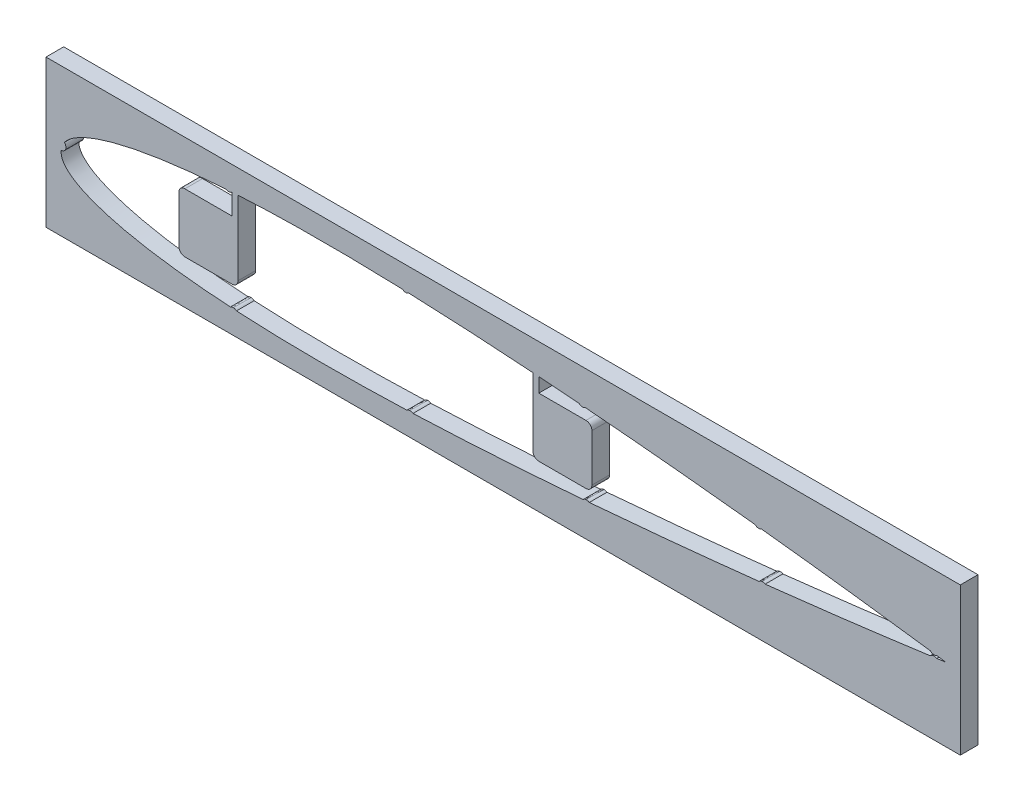
from build123d import *

# Parameters (mm, degrees)
SKETCH1_W           = 155
SKETCH1_H           = 25
BOSS_EXTRUDE1_DEPTH = 3
BOSS_EXTRUDE2_DEPTH = 3


with BuildPart() as part:
    # Sketch1 → Boss-Extrude1 (new body)
    with BuildSketch(Plane.XY):
        with Locations((-75.043432089, 5.950539177)):
            Rectangle(SKETCH1_W, SKETCH1_H)
        with BuildLine():
            Line((-120, 9.874355653), (-120, 1.874355653))
            ThreePointArc((-120, 1.874355653), (-120.292893219, 1.167248872), (-121, 0.874355653))
            Line((-121, 0.874355653), (-129, 0.874355653))
            ThreePointArc((-129, 0.874355653), (-129.707106781, 1.167248872), (-130, 1.874355653))
            Line((-130, 1.874355653), (-130, 10.026722702))
            ThreePointArc((-130, 10.026722702), (-129.675550532, 10.657645959), (-129, 10.874355653))
            Line((-129, 10.874355653), (-121, 10.874355653))
            Line((-121, 10.874355653), (-121, 14.383326896))
            add(Edge.make_bspline(
                [(-121, 14.383326896), (-121.225576082, 14.369446114), (-121.451128395, 14.355173583), (-121.676654377, 14.340496788)],
                knots=[0.794177557, 0.794177557, 0.794177557, 0.794177557, 0.798610741, 0.798610741, 0.798610741, 0.798610741], degree=3))
            add(Edge.make_bspline(
                [(-121.676654377, 14.340496788), (-123.141105811, 14.245193122), (-126.297275544, 14.002874731), (-130.966734827, 13.502135757), (-135.497553137, 12.829809722), (-138.919133497, 12.147248004), (-141.359035554, 11.532761702), (-142.966827408, 11.063139396), (-144.416586431, 10.569495063), (-145.705237538, 10.053484757), (-146.830159663, 9.516645923), (-147.789559274, 8.960196413), (-148.581406261, 8.384767274), (-149.206481665, 7.789808738), (-149.656785508, 7.173218222), (-149.945875273, 6.532334184), (-149.982262321, 6.089987443), (-150, 5.874355653)],
                knots=[0.798610741, 0.798610741, 0.798610741, 0.798610741, 0.827397593, 0.860698922, 0.890714333, 0.917222971, 0.929108019, 0.940059875, 0.950070168, 0.959138357, 0.967273832, 0.974500444, 0.980862986, 0.986437694, 0.991348141, 0.995782458, 1, 1, 1, 1], degree=3))
            add(Edge.make_bspline(
                [(-150, 5.874355653), (-149.982262321, 5.658723863), (-149.945875273, 5.216377122), (-149.656785508, 4.575493084), (-149.206481665, 3.958902568), (-148.581406261, 3.363944032), (-147.789559274, 2.788514893), (-146.830159663, 2.232065383), (-145.705237538, 1.695226549), (-144.416586431, 1.179216243), (-142.966827408, 0.68557191), (-141.359035554, 0.215949604), (-138.919133497, -0.398536698), (-135.497553137, -1.081098416), (-130.966734827, -1.753424451), (-125.915261757, -2.295129452), (-120.38969962, -2.698994916), (-113.346553824, -3.009849161), (-104.731447134, -3.120130228), (-94.550753071, -2.949624906), (-82.752820162, -2.472217615), (-69.615872509, -1.650520242), (-55.524910334, -0.507029139), (-41.215806763, 0.858742961), (-26.872092978, 2.413058536), (-13.42085951, 4.046159872), (-4.579151205, 5.229553883), (-0.494806727, 5.804304424), (-0.029189696, 5.870223183), (0, 5.874355653)],
                knots=[0, 0, 0, 0, 0.004217542, 0.008651859, 0.013562306, 0.019137014, 0.025499556, 0.032726168, 0.040861643, 0.049929832, 0.059940125, 0.070891981, 0.082777029, 0.109285667, 0.139301078, 0.172602407, 0.208924358, 0.247964735, 0.310881146, 0.377906083, 0.447678538, 0.542484027, 0.636086648, 0.724985379, 0.824439816, 0.919092539, 0.990775422, 0.999421708, 1, 1, 1, 1], degree=3))
            add(Edge.make_bspline(
                [(0, 5.874355653), (-0.029189696, 5.878488123), (-0.494806727, 5.944406882), (-4.579151205, 6.519157423), (-13.42085951, 7.702551434), (-26.872092978, 9.33565277), (-41.215806763, 10.889968345), (-55.339276668, 12.238022124), (-64.426731221, 12.978076031), (-69, 13.310196316)],
                knots=[0, 0, 0, 0, 0.000578292, 0.009224578, 0.080907461, 0.175560184, 0.275014621, 0.363913352, 0.453858128, 0.453858128, 0.453858128, 0.453858128], degree=3))
            Line((-69, 13.310196316), (-69, 10.874355653))
            Line((-69, 10.874355653), (-61, 10.874355653))
            ThreePointArc((-61, 10.874355653), (-60.292893219, 10.581462434), (-60, 9.874355653))
            Line((-60, 9.874355653), (-60, 1.874355653))
            ThreePointArc((-60, 1.874355653), (-60.292893219, 1.167248872), (-61, 0.874355653))
            Line((-61, 0.874355653), (-69, 0.874355653))
            ThreePointArc((-69, 0.874355653), (-69.707106781, 1.167248872), (-70, 1.874355653))
            Line((-70, 1.874355653), (-70, 9.874355653))
            Line((-70, 9.874355653), (-70, 13.382173037))
            add(Edge.make_bspline(
                [(-70, 13.382173037), (-74.673521975, 13.715522929), (-82.900428949, 14.22690196), (-94.550753071, 14.698336212), (-104.731447134, 14.868841534), (-113.170765072, 14.76081072), (-118.188410859, 14.544675383), (-120, 14.442325619)],
                knots=[0.460413652, 0.460413652, 0.460413652, 0.460413652, 0.552321462, 0.622093917, 0.689118854, 0.752035265, 0.787627618, 0.787627618, 0.787627618, 0.787627618], degree=3))
            Line((-120, 14.442325619), (-120, 9.874355653))
        make_face(mode=Mode.SUBTRACT)
    extrude(amount=BOSS_EXTRUDE1_DEPTH)

    # Sketch3 → Boss-Extrude2 (add)
    with BuildSketch(Plane.XY.offset(3)):
        with BuildLine():
            add(Edge.make_bspline(
                [(-1.870066252, 7.63933004), (-1.925569281, 7.644199553), (-2.034516531, 7.653757951), (-2.196277727, 7.628927154), (-2.349447825, 7.572035144), (-2.489016071, 7.482956839), (-2.612515344, 7.372139614), (-2.709996679, 7.239879331), (-2.779310689, 7.089119128), (-2.800168177, 6.9799255), (-2.810860739, 6.923947535)],
                knots=[0, 0, 0, 0, 1.01487162, 1.992097965, 2.960683225, 3.979797821, 4.998693386, 5.975234306, 6.962006619, 8, 8, 8, 8], degree=3))
            add(Edge.make_bspline(
                [(-2.810860739, 6.923947535), (-2.815711098, 6.868455422), (-2.825231899, 6.759529601), (-2.800532801, 6.596679966), (-2.741813637, 6.442885963), (-2.654617941, 6.300420475), (-2.542394397, 6.17824584), (-2.413843576, 6.077637994), (-2.264635334, 6.010357663), (-2.157866662, 5.988321439), (-2.103451068, 5.977090484)],
                knots=[0, 0, 0, 0, 1.017250327, 1.996767144, 2.984718075, 4.014456741, 5.035740444, 6.007519375, 6.984514713, 8, 8, 8, 8], degree=3))
            add(Edge.make_bspline(
                [(-2.103451068, 5.977090484), (-2.04790179, 5.971975695), (-1.938585288, 5.961910201), (-1.776672863, 5.99049312), (-1.621901708, 6.044932605), (-1.481516135, 6.135168193), (-1.358138666, 6.246782319), (-1.262837088, 6.380944607), (-1.193420628, 6.52981056), (-1.173002624, 6.63776912), (-1.162656581, 6.69247299)],
                knots=[0, 0, 0, 0, 1.015281961, 1.997993063, 2.976832369, 3.996359022, 5.026059393, 5.998794247, 6.98596554, 8, 8, 8, 8], degree=3))
            add(Edge.make_bspline(
                [(-1.162656581, 6.69247299), (-1.157391412, 6.749232604), (-1.147115979, 6.860003912), (-1.170946154, 7.024956792), (-1.229652859, 7.178523668), (-1.316652132, 7.31979596), (-1.427778496, 7.442576665), (-1.559377134, 7.539646112), (-1.708090284, 7.608700898), (-1.815374374, 7.62898798), (-1.870066252, 7.63933004)],
                knots=[0, 0, 0, 0, 1.037794969, 2.025346855, 3.010187337, 4.019462608, 5.037530918, 6.013278971, 6.987198353, 8, 8, 8, 8], degree=3))
        make_face()
        with BuildLine():
            add(Edge.make_bspline(
                [(-31.645039949, 11.33361577), (-31.700411186, 11.336691117), (-31.808842059, 11.342713424), (-31.968803391, 11.311625572), (-32.120580082, 11.25297175), (-32.256030981, 11.158720126), (-32.377390605, 11.046240351), (-32.469437656, 10.91041826), (-32.534627908, 10.757943572), (-32.551602656, 10.648525548), (-32.560336175, 10.592229898)],
                knots=[0, 0, 0, 0, 1.012917953, 1.983549283, 2.961176661, 3.974020675, 4.988932927, 5.977529819, 6.959437681, 8, 8, 8, 8], degree=3))
            add(Edge.make_bspline(
                [(-32.560336175, 10.592229898), (-32.564483473, 10.536348666), (-32.572567747, 10.427420098), (-32.540195137, 10.266478958), (-32.482619122, 10.113401498), (-32.389350322, 9.975913955), (-32.276527861, 9.854957115), (-32.142108077, 9.76339239), (-31.993299838, 9.695747345), (-31.885544916, 9.67957056), (-31.830475217, 9.671303182)],
                knots=[0, 0, 0, 0, 1.024721406, 1.99747629, 2.987400565, 4.010946832, 5.028079514, 6.007461816, 6.981684776, 8, 8, 8, 8], degree=3))
            add(Edge.make_bspline(
                [(-31.830475217, 9.671303182), (-31.775313486, 9.667607214), (-31.666549508, 9.660319769), (-31.505413171, 9.68946018), (-31.355136545, 9.753735432), (-31.216741938, 9.844785459), (-31.09647645, 9.960225428), (-31.003475206, 10.09587021), (-30.93945366, 10.247351932), (-30.921060213, 10.355079362), (-30.911707141, 10.409858787)],
                knots=[0, 0, 0, 0, 1.010507111, 1.992446048, 2.967035268, 3.988379424, 5.013529662, 6.002157841, 6.984096778, 8, 8, 8, 8], degree=3))
            add(Edge.make_bspline(
                [(-30.911707141, 10.409858787), (-30.908361579, 10.466484556), (-30.901847842, 10.576733701), (-30.931272893, 10.739691979), (-30.994277654, 10.890547056), (-31.083772626, 11.02938759), (-31.197317203, 11.14917838), (-31.331508162, 11.242287486), (-31.482564125, 11.305818063), (-31.590270985, 11.324245443), (-31.645039949, 11.33361577)],
                knots=[0, 0, 0, 0, 1.036127545, 2.017317846, 3.001172052, 4.012980307, 5.027150879, 6.003681006, 6.984871308, 8, 8, 8, 8], degree=3))
        make_face()
        with BuildLine():
            add(Edge.make_bspline(
                [(-61.526597035, 14.232079969), (-61.582283043, 14.234092449), (-61.691797379, 14.238050272), (-61.852541511, 14.20345358), (-62.002578369, 14.137051669), (-62.136157956, 14.038839832), (-62.253692012, 13.921463385), (-62.345554446, 13.783862325), (-62.404036387, 13.627422401), (-62.419299816, 13.517002449), (-62.427088277, 13.460658525)],
                knots=[0, 0, 0, 0, 1.011321663, 1.988905726, 2.963385499, 3.977771559, 4.989677632, 5.974717091, 6.966560061, 8, 8, 8, 8], degree=3))
            add(Edge.make_bspline(
                [(-62.427088277, 13.460658525), (-62.429128644, 13.404960829), (-62.433141312, 13.295423508), (-62.398023938, 13.134295319), (-62.332580417, 12.982715728), (-62.234381025, 12.847526942), (-62.119034312, 12.727567268), (-61.980559441, 12.639149795), (-61.828495734, 12.577384159), (-61.719684776, 12.562885614), (-61.664549435, 12.555539091)],
                knots=[0, 0, 0, 0, 1.014352598, 1.994866485, 2.982481805, 4.008566467, 5.030585686, 6.002494066, 6.987848531, 8, 8, 8, 8], degree=3))
            add(Edge.make_bspline(
                [(-61.664549435, 12.555539091), (-61.608804354, 12.553279676), (-61.498928558, 12.548826279), (-61.339157391, 12.587040561), (-61.187849995, 12.650639128), (-61.052597081, 12.748091523), (-60.935360191, 12.867099009), (-60.846525854, 13.005208663), (-60.786994832, 13.158688544), (-60.772269055, 13.267265218), (-60.764708996, 13.323007337)],
                knots=[0, 0, 0, 0, 1.014422888, 1.999468295, 2.970295884, 3.996451649, 5.021447424, 6.00460396, 6.975584712, 8, 8, 8, 8], degree=3))
            add(Edge.make_bspline(
                [(-60.764708996, 13.323007337), (-60.76242344, 13.379996716), (-60.757954684, 13.491423273), (-60.792199301, 13.654903047), (-60.858713551, 13.805921096), (-60.95357425, 13.943468027), (-61.073447621, 14.058590831), (-61.209066774, 14.151672928), (-61.363180163, 14.209426486), (-61.471594181, 14.224455259), (-61.526597035, 14.232079969)],
                knots=[0, 0, 0, 0, 1.034225871, 2.022135156, 3.005780226, 4.019261856, 5.040066372, 6.013007039, 6.991917418, 8, 8, 8, 8], degree=3))
        make_face()
        with BuildLine():
            add(Edge.make_bspline(
                [(-91.495436534, 16.053737794), (-91.55140781, 16.053308858), (-91.660944146, 16.052469428), (-91.820539926, 16.012008698), (-91.965989664, 15.937618086), (-92.097336485, 15.836882698), (-92.207932065, 15.713372857), (-92.292320259, 15.572479739), (-92.345185859, 15.415065538), (-92.355128503, 15.304598661), (-92.360238568, 15.247823728)],
                knots=[0, 0, 0, 0, 1.019009817, 1.994212216, 2.972532837, 3.98275666, 4.999430969, 5.980632802, 6.962137427, 8, 8, 8, 8], degree=3))
            add(Edge.make_bspline(
                [(-92.360238568, 15.247823728), (-92.359804754, 15.191854453), (-92.358955775, 15.082322032), (-92.318564368, 14.922697829), (-92.243678617, 14.776907862), (-92.143620312, 14.644901985), (-92.022712975, 14.530523883), (-91.881250306, 14.448309589), (-91.727126232, 14.391833231), (-91.618281602, 14.382406933), (-91.562744481, 14.377597237)],
                knots=[0, 0, 0, 0, 1.022319469, 2.000689238, 2.982187357, 4.00487245, 5.022794195, 6.007182883, 6.983180658, 8, 8, 8, 8], degree=3))
            add(Edge.make_bspline(
                [(-91.562744481, 14.377597237), (-91.506646554, 14.377628255), (-91.397283369, 14.377688724), (-91.239637511, 14.423576764), (-91.091104578, 14.492182198), (-90.961711806, 14.59700354), (-90.849386533, 14.719122426), (-90.768780487, 14.862025979), (-90.712492402, 15.016501293), (-90.702933546, 15.125980942), (-90.698084931, 15.181513172)],
                knots=[0, 0, 0, 0, 1.021787889, 1.991980517, 2.977374506, 3.998504286, 5.0179503, 5.996422219, 6.983709378, 8, 8, 8, 8], degree=3))
            add(Edge.make_bspline(
                [(-90.698084931, 15.181513172), (-90.698193618, 15.238232313), (-90.698406723, 15.349443222), (-90.74263803, 15.509628916), (-90.812499651, 15.658449728), (-90.914775354, 15.788482036), (-91.036018637, 15.90073782), (-91.176881172, 15.983099256), (-91.331067727, 16.039482512), (-91.439903786, 16.048921582), (-91.495436534, 16.053737794)],
                knots=[0, 0, 0, 0, 1.032493919, 2.024441557, 3.008473088, 4.020050434, 5.028456568, 6.010973038, 6.985114555, 8, 8, 8, 8], degree=3))
        make_face()
        with BuildLine():
            add(Edge.make_bspline(
                [(-121.588524465, 15.868630626), (-121.643778927, 15.863040165), (-121.752688882, 15.852021022), (-121.908694026, 15.799835738), (-122.047652038, 15.712588783), (-122.169840809, 15.600174994), (-122.271165571, 15.468356529), (-122.34428821, 15.320346092), (-122.384029345, 15.158665497), (-122.383704188, 15.047166294), (-122.383537886, 14.990139759)],
                knots=[0, 0, 0, 0, 1.009551691, 1.989888666, 2.964247229, 3.976579052, 5.000028149, 5.974917924, 6.96426692, 8, 8, 8, 8], degree=3))
            add(Edge.make_bspline(
                [(-122.383537886, 14.990139759), (-122.37798262, 14.934185606), (-122.367161857, 14.825195924), (-122.313889157, 14.668981987), (-122.227381639, 14.529035248), (-122.11523964, 14.405770469), (-121.984636675, 14.302469565), (-121.836793924, 14.231251342), (-121.677945416, 14.187640829), (-121.568012287, 14.187981496), (-121.512238118, 14.188154332)],
                knots=[0, 0, 0, 0, 1.024046003, 1.994676734, 2.982380645, 4.007006927, 5.024136818, 6.00125248, 6.985942794, 8, 8, 8, 8], degree=3))
            add(Edge.make_bspline(
                [(-121.512238118, 14.188154332), (-121.45688182, 14.193482042), (-121.347634798, 14.20399641), (-121.193236983, 14.259976061), (-121.051777181, 14.344132715), (-120.929291825, 14.457926767), (-120.830095783, 14.593153304), (-120.758030138, 14.741394933), (-120.717302642, 14.901344641), (-120.717250971, 15.01092541), (-120.717224697, 15.066645198)],
                knots=[0, 0, 0, 0, 1.010861704, 1.994960552, 2.965630447, 3.996252168, 5.021318713, 6.007675535, 6.986939972, 8, 8, 8, 8], degree=3))
            add(Edge.make_bspline(
                [(-120.717224697, 15.066645198), (-120.722892724, 15.123262021), (-120.734000635, 15.234216784), (-120.787263143, 15.392088741), (-120.871332488, 15.534109281), (-120.984278184, 15.656107801), (-121.116906219, 15.755416852), (-121.26370429, 15.828253871), (-121.42325457, 15.868477365), (-121.532815012, 15.868578964), (-121.588524465, 15.868630626)],
                knots=[0, 0, 0, 0, 1.034052986, 2.026484328, 3.00721666, 4.019723006, 5.03485659, 6.009914434, 6.98807841, 8, 8, 8, 8], degree=3))
        make_face()
        with BuildLine():
            add(Edge.make_bspline(
                [(-150.745376314, 7.254618318), (-150.768040718, 7.204108659), (-150.812615997, 7.104768646), (-150.841871361, 6.943717408), (-150.835817494, 6.780862404), (-150.800128369, 6.619748813), (-150.7342672, 6.468239039), (-150.641579508, 6.332766932), (-150.521548666, 6.218791206), (-150.425690709, 6.163448569), (-150.377025266, 6.13535206)],
                knots=[0, 0, 0, 0, 1.011876763, 1.990111407, 2.967733411, 3.981754218, 4.997251038, 5.976633352, 6.972771419, 8, 8, 8, 8], degree=3))
            add(Edge.make_bspline(
                [(-150.377025266, 6.13535206), (-150.32651187, 6.112624973), (-150.227164508, 6.067926412), (-150.065790145, 6.039505555), (-149.901724787, 6.042247056), (-149.740058576, 6.080961929), (-149.586798087, 6.144100331), (-149.450771409, 6.234994239), (-149.335968453, 6.352478689), (-149.282071641, 6.447650274), (-149.2546651, 6.496045049)],
                knots=[0, 0, 0, 0, 1.012421914, 1.991183585, 2.976282326, 4.002092948, 5.020863322, 6.001155744, 6.983587211, 8, 8, 8, 8], degree=3))
            add(Edge.make_bspline(
                [(-149.2546651, 6.496045049), (-149.231821768, 6.546532972), (-149.186703571, 6.646252405), (-149.160115554, 6.808132754), (-149.164335616, 6.97199253), (-149.204951204, 7.132281519), (-149.268757004, 7.285084643), (-149.364675355, 7.417286594), (-149.48079209, 7.533028339), (-149.576147699, 7.586793339), (-149.624636049, 7.614132855)],
                knots=[0, 0, 0, 0, 1.013255866, 2.001296436, 2.980250856, 4.002141009, 5.019021866, 5.999509257, 6.982749972, 8, 8, 8, 8], degree=3))
            add(Edge.make_bspline(
                [(-149.624636049, 7.614132855), (-149.676428516, 7.637662613), (-149.776978943, 7.683343525), (-149.939877018, 7.712133495), (-150.103194238, 7.708945132), (-150.264634103, 7.672382167), (-150.416256559, 7.606821394), (-150.550148394, 7.514555943), (-150.664432954, 7.39766197), (-150.7179816, 7.303030442), (-150.745376314, 7.254618318)],
                knots=[0, 0, 0, 0, 1.039565966, 2.018224041, 3.003218516, 4.017678243, 5.033614623, 6.013420864, 6.983694792, 8, 8, 8, 8], degree=3))
        make_face()
        with BuildLine():
            add(Edge.make_bspline(
                [(-120.851293542, -4.142264451), (-120.90651468, -4.136519536), (-121.015477821, -4.125183587), (-121.169249072, -4.06898928), (-121.309984884, -3.985322722), (-121.429448244, -3.870604341), (-121.530582502, -3.738552122), (-121.599323401, -3.588652206), (-121.63991024, -3.427289646), (-121.639012358, -3.31584607), (-121.638553158, -3.25885099)],
                knots=[0, 0, 0, 0, 1.009338913, 1.991642034, 2.958726526, 3.975532906, 4.993724234, 5.974516119, 6.964115998, 8, 8, 8, 8], degree=3))
            add(Edge.make_bspline(
                [(-121.638553158, -3.25885099), (-121.632998397, -3.202898868), (-121.622163823, -3.09376411), (-121.564192459, -2.940098861), (-121.482435358, -2.798311265), (-121.366261674, -2.678705064), (-121.235385298, -2.576350125), (-121.087530312, -2.504367176), (-120.928206408, -2.464500817), (-120.818789782, -2.465217389), (-120.763152517, -2.465581759)],
                knots=[0, 0, 0, 0, 1.024410703, 1.998115712, 2.97854022, 3.998352384, 5.026905955, 6.004816062, 6.985468832, 8, 8, 8, 8], degree=3))
            add(Edge.make_bspline(
                [(-120.763152517, -2.465581759), (-120.707986334, -2.471415401), (-120.599131631, -2.482926426), (-120.443899216, -2.538078751), (-120.305682522, -2.627191343), (-120.184813207, -2.740936435), (-120.08387544, -2.873372912), (-120.015518573, -3.022615385), (-119.974613827, -3.181857345), (-119.975461744, -3.291327521), (-119.975892901, -3.346992015)],
                knots=[0, 0, 0, 0, 1.012297478, 1.997479918, 2.980236169, 4.000023003, 5.021198845, 6.004865618, 6.985494031, 8, 8, 8, 8], degree=3))
            add(Edge.make_bspline(
                [(-119.975892901, -3.346992015), (-119.981565315, -3.403560568), (-119.992692461, -3.514526843), (-120.049230443, -3.670808556), (-120.132185765, -3.813425896), (-120.247593436, -3.933175557), (-120.379213733, -4.033715712), (-120.527388769, -4.103086765), (-120.686190021, -4.143466242), (-120.795639548, -4.142669557), (-120.851293542, -4.142264451)],
                knots=[0, 0, 0, 0, 1.033597219, 2.027529919, 3.005207022, 4.022161406, 5.040500939, 6.010407088, 6.988311813, 8, 8, 8, 8], degree=3))
        make_face()
        with BuildLine():
            add(Edge.make_bspline(
                [(-90.776728844, -4.281665047), (-90.832409421, -4.281397338), (-90.942046449, -4.28087021), (-91.100847977, -4.238455686), (-91.247959766, -4.167243647), (-91.379210322, -4.066527964), (-91.492030323, -3.944506297), (-91.572405469, -3.800468545), (-91.627377486, -3.64372604), (-91.637133952, -3.532926494), (-91.64211346, -3.476376586)],
                knots=[0, 0, 0, 0, 1.012391259, 1.99343427, 2.968786948, 3.977579692, 4.995454243, 5.977706926, 6.967861404, 8, 8, 8, 8], degree=3))
            add(Edge.make_bspline(
                [(-91.64211346, -3.476376586), (-91.641615757, -3.420759903), (-91.640637215, -3.311411012), (-91.601626934, -3.151844033), (-91.528847789, -3.005077396), (-91.429986096, -2.871622769), (-91.30594929, -2.760436576), (-91.166838993, -2.674326489), (-91.01150463, -2.619691655), (-90.902695518, -2.609971803), (-90.846841024, -2.604982355)],
                knots=[0, 0, 0, 0, 1.015751309, 1.997085679, 2.975675479, 3.997586468, 5.018839269, 6.006245371, 6.976554883, 8, 8, 8, 8], degree=3))
            add(Edge.make_bspline(
                [(-90.846841024, -2.604982355), (-90.791192801, -2.605319478), (-90.681619479, -2.605983287), (-90.522647127, -2.6473223), (-90.377170735, -2.722280368), (-90.246726536, -2.82395092), (-90.134246144, -2.946324757), (-90.051763149, -3.087364593), (-89.993415502, -3.241064604), (-89.984182882, -3.350303563), (-89.979453203, -3.406264406)],
                knots=[0, 0, 0, 0, 1.016655847, 2.001831396, 2.97577537, 3.996252141, 5.018414379, 6.000394015, 6.975643493, 8, 8, 8, 8], degree=3))
            add(Edge.make_bspline(
                [(-89.979453203, -3.406264406), (-89.97969062, -3.463275077), (-89.980155403, -3.574883356), (-90.022268879, -3.735817063), (-90.09421652, -3.884427362), (-90.195927365, -4.015473112), (-90.316967843, -4.129284984), (-90.457486113, -4.211809962), (-90.611952172, -4.267121628), (-90.720835999, -4.276731867), (-90.776728844, -4.281665047)],
                knots=[0, 0, 0, 0, 1.036123955, 2.028392401, 3.00317457, 4.028438216, 5.036714415, 6.014002944, 6.980537043, 8, 8, 8, 8], degree=3))
        make_face()
        with BuildLine():
            add(Edge.make_bspline(
                [(-60.832379514, -2.431423628), (-60.887915289, -2.432888556), (-60.997379729, -2.43577602), (-61.158199886, -2.403104009), (-61.308287377, -2.336440094), (-61.44467726, -2.240950003), (-61.561973618, -2.122380488), (-61.653388079, -1.984846691), (-61.712596197, -1.829238782), (-61.727959678, -1.718755092), (-61.735825027, -1.662192858)],
                knots=[0, 0, 0, 0, 1.008658703, 1.988128532, 2.956683018, 3.978070927, 5.000614742, 5.97464219, 6.963116067, 8, 8, 8, 8], degree=3))
            add(Edge.make_bspline(
                [(-61.735825027, -1.662192858), (-61.738558323, -1.605886692), (-61.743889263, -1.496068839), (-61.705363722, -1.336150559), (-61.644412528, -1.183928991), (-61.546269228, -1.048821526), (-61.431661698, -0.927602909), (-61.293026283, -0.838514392), (-61.141089623, -0.775100959), (-61.031971143, -0.761593762), (-60.976610283, -0.754740935)],
                knots=[0, 0, 0, 0, 1.02379044, 1.996770059, 2.974622982, 3.999066142, 5.024668667, 6.001609697, 6.986124027, 8, 8, 8, 8], degree=3))
            add(Edge.make_bspline(
                [(-60.976610283, -0.754740935), (-60.920318317, -0.75204672), (-60.810528161, -0.746792004), (-60.650152772, -0.784827633), (-60.498625449, -0.847993751), (-60.364845091, -0.94831006), (-60.246807728, -1.065520648), (-60.156160461, -1.202931501), (-60.096594584, -1.356200441), (-60.08106791, -1.464725567), (-60.07316477, -1.519965294)],
                knots=[0, 0, 0, 0, 1.023850534, 1.996887265, 2.97957142, 4.001170373, 5.026833098, 6.003831472, 6.983942161, 8, 8, 8, 8], degree=3))
            add(Edge.make_bspline(
                [(-60.07316477, -1.519965294), (-60.070802796, -1.57684455), (-60.066173763, -1.688317394), (-60.099692473, -1.851657958), (-60.165449328, -2.003575022), (-60.261782237, -2.139493326), (-60.378197829, -2.258260742), (-60.51538139, -2.348370907), (-60.668605348, -2.408008702), (-60.777136645, -2.42352551), (-60.832379514, -2.431423628)],
                knots=[0, 0, 0, 0, 1.032450455, 2.023412341, 3.002692539, 4.023647015, 5.037131964, 6.010746077, 6.987461722, 8, 8, 8, 8], degree=3))
        make_face()
        with BuildLine():
            add(Edge.make_bspline(
                [(-30.978546282, 0.484203935), (-31.034035319, 0.480488134), (-31.142488611, 0.473225603), (-31.303163294, 0.503091865), (-31.453526502, 0.565056399), (-31.593020051, 0.654216915), (-31.712571254, 0.769203713), (-31.804477908, 0.904506698), (-31.869308206, 1.056291694), (-31.886952059, 1.165362742), (-31.896014231, 1.221383422)],
                knots=[0, 0, 0, 0, 1.01617143, 1.986106501, 2.963426972, 3.981954403, 5.003345863, 5.981049462, 6.963033878, 8, 8, 8, 8], degree=3))
            add(Edge.make_bspline(
                [(-31.896014231, 1.221383422), (-31.899755049, 1.276898326), (-31.907110834, 1.386060448), (-31.876445645, 1.547382192), (-31.818415351, 1.700554611), (-31.727091962, 1.839202711), (-31.615210039, 1.96190385), (-31.480616098, 2.05492298), (-31.330608774, 2.119838832), (-31.223531023, 2.13772861), (-31.168850769, 2.146864191)],
                knots=[0, 0, 0, 0, 1.01730789, 2.000390532, 2.98568518, 4.005351705, 5.028325863, 6.014077547, 6.985870166, 8, 8, 8, 8], degree=3))
            add(Edge.make_bspline(
                [(-31.168850769, 2.146864191), (-31.113316433, 2.150768381), (-31.003995347, 2.158453901), (-30.843207006, 2.125442251), (-30.691497621, 2.065057614), (-30.554718368, 1.97188749), (-30.434711259, 1.857551862), (-30.341664215, 1.723103896), (-30.273570739, 1.573331286), (-30.256250483, 1.465124631), (-30.247376411, 1.409684704)],
                knots=[0, 0, 0, 0, 1.016266219, 2.000551976, 2.977963612, 3.99304967, 5.014536406, 5.999278732, 6.974925878, 8, 8, 8, 8], degree=3))
            add(Edge.make_bspline(
                [(-30.247376411, 1.409684704), (-30.243606099, 1.3528473), (-30.236278002, 1.242376303), (-30.266450512, 1.079254926), (-30.327272528, 0.926409579), (-30.419778145, 0.788484443), (-30.532070483, 0.667659579), (-30.666069074, 0.57524182), (-30.81629745, 0.511616738), (-30.923905739, 0.493435746), (-30.978546282, 0.484203935)],
                knots=[0, 0, 0, 0, 1.039082297, 2.019593563, 3.006784345, 4.030444087, 5.041847504, 6.008011484, 6.98852275, 8, 8, 8, 8], degree=3))
        make_face()
        with BuildLine():
            add(Edge.make_bspline(
                [(-1.883012821, 4.125557576), (-1.938481198, 4.121185306), (-2.047419907, 4.11259826), (-2.208402794, 4.140557219), (-2.360678039, 4.198247513), (-2.501396189, 4.285399737), (-2.622478892, 4.399012752), (-2.71981565, 4.531291556), (-2.785167743, 4.683789609), (-2.805871829, 4.792748349), (-2.81650641, 4.848714627)],
                knots=[0, 0, 0, 0, 1.014040895, 1.991554677, 2.957563385, 3.977394448, 4.996713787, 5.976055838, 6.960408122, 8, 8, 8, 8], degree=3))
            add(Edge.make_bspline(
                [(-2.81650641, 4.848714627), (-2.820851497, 4.90418678), (-2.829436786, 5.013792051), (-2.801401386, 5.175993334), (-2.744435113, 5.330013899), (-2.655996968, 5.471164559), (-2.544021379, 5.593726662), (-2.412348079, 5.690917252), (-2.263708554, 5.759510717), (-2.156107386, 5.778537438), (-2.101362179, 5.788217832)],
                knots=[0, 0, 0, 0, 1.015331675, 2.006154428, 2.984836147, 4.005965362, 5.03554826, 6.006256878, 6.985625525, 8, 8, 8, 8], degree=3))
            add(Edge.make_bspline(
                [(-2.101362179, 5.788217832), (-2.045929934, 5.792348142), (-1.937166492, 5.800452211), (-1.774911211, 5.775865871), (-1.622300066, 5.71623815), (-1.483358168, 5.625536275), (-1.361576959, 5.513012858), (-1.265135545, 5.379925624), (-1.1969025, 5.229939149), (-1.17762302, 5.121784633), (-1.16786859, 5.067063986)],
                knots=[0, 0, 0, 0, 1.015506694, 1.992522628, 2.975716235, 3.993208425, 5.014001194, 5.994758888, 6.985450671, 8, 8, 8, 8], degree=3))
            add(Edge.make_bspline(
                [(-1.16786859, 5.067063986), (-1.162590403, 5.010254187), (-1.152284913, 4.899334876), (-1.18119878, 4.735855766), (-1.237541496, 4.581113596), (-1.328215279, 4.442045691), (-1.439112776, 4.318801103), (-1.571331702, 4.222916044), (-1.721357936, 4.157120487), (-1.828363089, 4.136227867), (-1.883012821, 4.125557576)],
                knots=[0, 0, 0, 0, 1.037443643, 2.025575432, 3.00159916, 4.026429695, 5.035990113, 6.013915608, 6.985665873, 8, 8, 8, 8], degree=3))
        make_face()
    extrude(amount=-BOSS_EXTRUDE2_DEPTH)


solid = part.part
